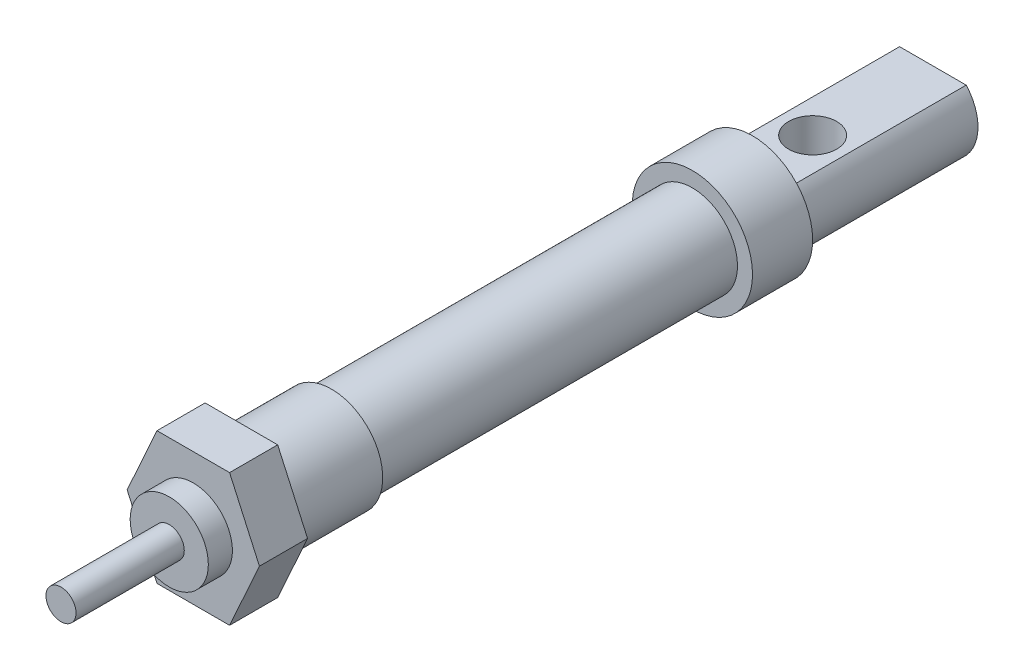
from build123d import *

# Parameters (mm, degrees)
SKETCH1_R               = 9.525
BOSS_EXTRUDE1_DEPTH     = 38.1
SKETCH2_R               = 12.7
BOSS_EXTRUDE2_DEPTH     = 12.7
SKETCH3_R               = 9.525
BOSS_EXTRUDE3_DEPTH     = 76.2
SKETCH4_R               = 10.795
BOSS_EXTRUDE4_DEPTH     = 19.05
BOSS_EXTRUDE5_DEPTH     = 10.16
SKETCH6_R               = 8.255
BOSS_EXTRUDE6_DEPTH     = 5.08
SKETCH7_R               = 3.175
BOSS_EXTRUDE7_DEPTH     = 22.86
CUT_EXTRUDE1_DEPTH      = 22.86
CUT_EXTRUDE1_DEPTH_BACK = 22.86
SKETCH8_R               = 5.08
SKETCH9_W               = 16.087027097
SKETCH9_H               = 5.943828254
CUT_EXTRUDE2_DEPTH      = 38.1


with BuildPart() as part:
    # Sketch1 → Boss-Extrude1 (new body)
    with BuildSketch(Plane.XY):
        with Locations(Location((0, 0, 0), (0, 0, 180))):
            Circle(SKETCH1_R)
    extrude(amount=BOSS_EXTRUDE1_DEPTH)

    # Sketch2 → Boss-Extrude2 (add)
    with BuildSketch(Plane.XY.offset(38.1)):
        Circle(SKETCH2_R)
    extrude(amount=BOSS_EXTRUDE2_DEPTH)

    # Sketch3 → Boss-Extrude3 (add)
    with BuildSketch(Plane.XY.offset(50.8)):
        with Locations(Location((0, 0, 0), (0, 0, 180))):
            Circle(SKETCH3_R)
    extrude(amount=BOSS_EXTRUDE3_DEPTH)

    # Sketch4 → Boss-Extrude4 (add)
    with BuildSketch(Plane.XY.offset(127)):
        with Locations(Location((0, 0, 0), (0, 0, 180))):
            Circle(SKETCH4_R)
    extrude(amount=BOSS_EXTRUDE4_DEPTH)

    # Sketch5 → Boss-Extrude5 (add)
    with BuildSketch(Plane.XY.offset(146.05)):
        Polygon((-7.663715272, 13.97), (7.663715272, 13.97), (13.97, 0), (7.663715272, -13.97), (-7.663715272, -13.97), (-13.97, 0), align=None)
    extrude(amount=BOSS_EXTRUDE5_DEPTH)

    # Sketch6 → Boss-Extrude6 (add)
    with BuildSketch(Plane.XY.offset(156.21)):
        with Locations(Location((0, 0, 0), (0, 0, 180))):
            Circle(SKETCH6_R)
    extrude(amount=BOSS_EXTRUDE6_DEPTH)

    # Sketch7 → Boss-Extrude7 (add)
    with BuildSketch(Plane.XY.offset(161.29)):
        Circle(SKETCH7_R)
    extrude(amount=BOSS_EXTRUDE7_DEPTH)

    # Sketch8 → Cut-Extrude1 (cut, two sides: drawn at the far end of the back side and taken through both)
    with BuildSketch(Plane(origin=(0, 0, 0), x_dir=(1, 0, 0), z_dir=(0, 1, 0)).offset(-CUT_EXTRUDE1_DEPTH_BACK)):
        with Locations(Location((0, -25.4, 0), (0, 0, 90))):
            Circle(SKETCH8_R)
    extrude(amount=CUT_EXTRUDE1_DEPTH + CUT_EXTRUDE1_DEPTH_BACK, mode=Mode.SUBTRACT)

    # Sketch9 → Cut-Extrude2 (cut)
    with BuildSketch(Plane(origin=(0, 0, 0), x_dir=(-1, 0, 0), z_dir=(0, 0, -1))):
        with Locations((1.010043222, 9.394991284)):
            Rectangle(SKETCH9_W, SKETCH9_H)
    cut_extrude2 = extrude(amount=-CUT_EXTRUDE2_DEPTH, mode=Mode.SUBTRACT)

    # Mirror1: Cut-Extrude2 across plane
    add(cut_extrude2.mirror(Plane.ZX), mode=Mode.SUBTRACT)


solid = part.part
